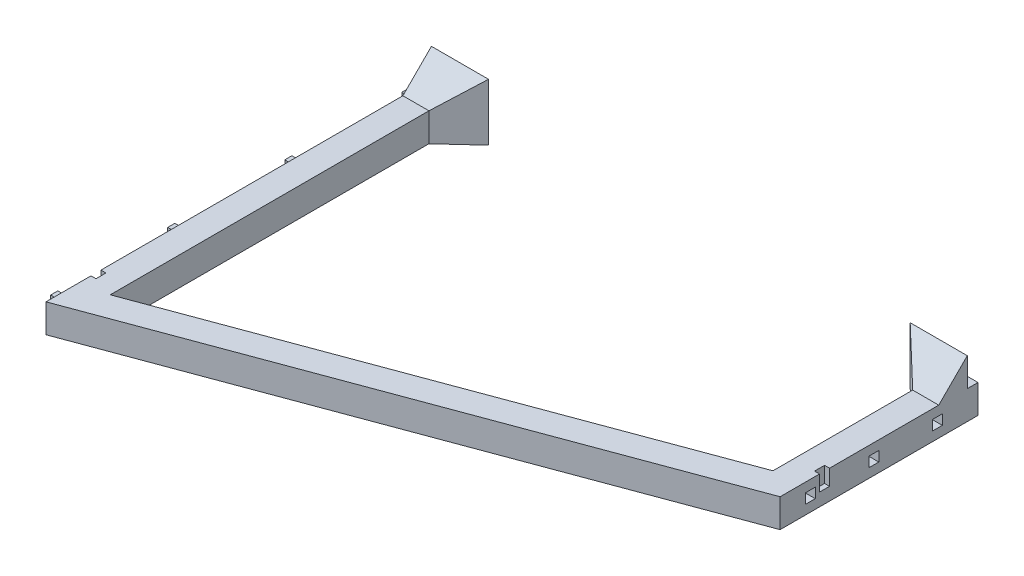
from build123d import *

# Parameters (mm, degrees)
P_IDAT_VYSUNUT_M1_DEPTH  = 8
SKICA2_W                 = 1.4
SKICA2_H                 = 2.8
ODEBRAT_VYSUNUT_M1_DEPTH = 4.4
SKICA3_W                 = 2
SKICA3_H                 = 2
P_IDAT_VYSUNUT_M2_DEPTH  = 4
P_IDAT_START             = 8
SKICA5_W                 = 16
SKICA5_H                 = 8
P_IDAT_VYSUNUT_M3_DEPTH  = 16
ODEBRAT_VYSUNUT_M3_DEPTH = 191.628493411
ODEBRAT_VYSUNUT_M4_DEPTH = 188.40870444
SKICA4_W                 = 2.8
SKICA4_H                 = 2.8
ODEBRAT_VYSUNUT_M2_DEPTH = 4.4
SKICA8_W                 = 1.4
SKICA8_H                 = 2.8
ODEBRAT_VYSUNUT_M5_DEPTH = 4.4


with BuildPart() as part:
    # Skica1 → Přidat vysunutím1 (new body)
    with BuildSketch(Plane(origin=(0, 0, 0), x_dir=(1, 0, 0), z_dir=(0, 1, 0))):
        Polygon((0, 0), (0, -111), (150.15, -55.45), (150.15, 0), (142.85, 0), (142.85, -50.153914462), (7.3, -100.30244926), (7.3, 0), align=None)
    extrude(amount=P_IDAT_VYSUNUT_M1_DEPTH)

    # Skica2 → Odebrat vysunutím1 (cut)
    with BuildSketch(Plane(origin=(0, 8, 0), x_dir=(1, 0, 0), z_dir=(0, 1, 0))):
        with Locations((0.7, -97)):
            Rectangle(SKICA2_W, SKICA2_H)
    extrude(amount=-ODEBRAT_VYSUNUT_M1_DEPTH, mode=Mode.SUBTRACT)

    # Skica3 → Přidat vysunutím2 (add)
    with BuildSketch(Plane.ZY):
        with Locations((6.3, 4)):
            Rectangle(SKICA3_W, SKICA3_H)
        with Locations((39.1, 4)):
            Rectangle(SKICA3_W, SKICA3_H)
        with Locations((71.9, 4)):
            Rectangle(SKICA3_W, SKICA3_H)
        with Locations((104.7, 4)):
            Rectangle(SKICA3_W, SKICA3_H)
    extrude(amount=P_IDAT_VYSUNUT_M2_DEPTH)

    # Skica5 → Přidat vysunutím3 (add)
    with BuildSketch(Plane(origin=(0, 8, 0), x_dir=(1, 0, 0), z_dir=(0, 1, 0)).offset(P_IDAT_START)):
        with Locations((8, -7)):
            Rectangle(SKICA5_W, SKICA5_H)
        with Locations((142.15, -7)):
            Rectangle(SKICA5_W, SKICA5_H)
    extrude(amount=-P_IDAT_VYSUNUT_M3_DEPTH)

    # Skica6 → Odebrat vysunutím3 (cut, through all)
    with BuildSketch(Plane(origin=(150.15, 0, 0), x_dir=(0, 0, -1), z_dir=(1, 0, 0))):
        Polygon((-11, 8), (-11, 16), (-3, 16), align=None)
    extrude(amount=-ODEBRAT_VYSUNUT_M3_DEPTH, mode=Mode.SUBTRACT)

    # Skica7 → Odebrat vysunutím4 (cut, through all)
    with BuildSketch(Plane.XZ):
        Polygon((7.3, 11), (16, 3), (16, 11), align=None)
        Polygon((134.15, 3), (134.15, 11), (142.85, 11), align=None)
    extrude(amount=-ODEBRAT_VYSUNUT_M4_DEPTH, mode=Mode.SUBTRACT)

    # Skica4 → Odebrat vysunutím2 (cut)
    with BuildSketch(Plane(origin=(150.15, 0, 0), x_dir=(0, 0, -1), z_dir=(1, 0, 0))):
        with Locations((-47, 4)):
            Rectangle(SKICA4_W, SKICA4_H)
        with Locations((-29.2, 4)):
            Rectangle(SKICA4_W, SKICA4_H)
        with Locations((-11.4, 4)):
            Rectangle(SKICA4_W, SKICA4_H)
    extrude(amount=-ODEBRAT_VYSUNUT_M2_DEPTH, mode=Mode.SUBTRACT)

    # Skica8 → Odebrat vysunutím5 (cut)
    with BuildSketch(Plane(origin=(0, 8, 0), x_dir=(1, 0, 0), z_dir=(0, 1, 0))):
        with Locations((149.45, -43)):
            Rectangle(SKICA8_W, SKICA8_H)
    extrude(amount=-ODEBRAT_VYSUNUT_M5_DEPTH, mode=Mode.SUBTRACT)


solid = part.part
